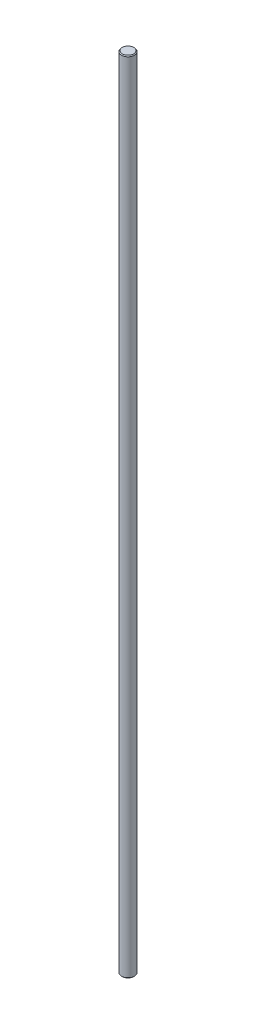
from build123d import *


with BuildPart() as part:
    # Sketch1 → Revolve1 (revolve)
    with BuildSketch(Plane.XY, mode=Mode.PRIVATE) as revolve1_sk:
        Polygon((3.5, 495), (0, 495), (0, 0), (3.5, 0), (4, 0.5), (4, 494.5), align=None)
    revolve(revolve1_sk.sketch.rotate(Axis((0, 495, 0), (0, -1, 0)), 270), axis=Axis((0, 495, 0), (0, -1, 0)))


solid = part.part
